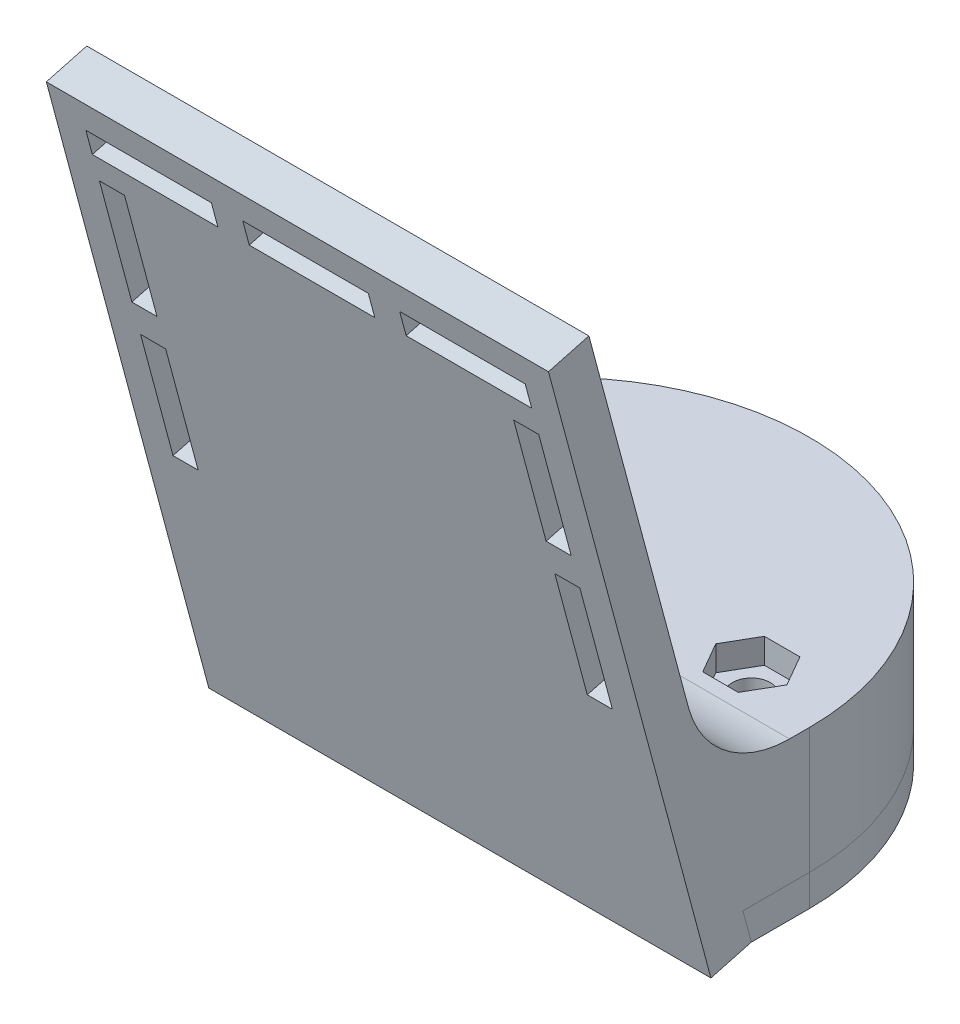
from build123d import *

# Parameters (mm, degrees)
SKETCH1_R           = 7.5
BOSS_EXTRUDE1_DEPTH = 2
SKETCH2_R           = 15.125
SKETCH2_R_2         = 2.25
BOSS_EXTRUDE2_DEPTH = 1.75
BOSS_EXTRUDE3_DEPTH = 15
CUT_EXTRUDE2_DEPTH  = 60
SKETCH8_W           = 60
SKETCH8_H           = 75
BOSS_EXTRUDE4_DEPTH = 5
SKETCH9_R           = 2.25
CUT_EXTRUDE4_DEPTH  = 20
SKETCH10_W          = 15
SKETCH10_H          = 3
SKETCH10_W_2        = 3
SKETCH10_H_2        = 15
CUT_EXTRUDE5_DEPTH  = 25
CUT_EXTRUDE6_DEPTH  = 3
FILLET1_R           = 12.5


with BuildPart() as part:
    # Sketch1 → Boss-Extrude1 (new body)
    with BuildSketch(Plane(origin=(0, 0, 0), x_dir=(1, 0, 0), z_dir=(0, 1, 0))):
        with BuildLine():
            Line((30, -6.04597789), (-30, -6.04597789))
            Line((-30, -6.04597789), (-30, 5.95402211))
            ThreePointArc((-30, 5.95402211), (0, 35.95402211), (30, 5.95402211))
            Line((30, 5.95402211), (30, -6.04597789))
        make_face()
        with Locations(Location((0, 18.45402211, 0), (0, 0, 270))):
            Circle(SKETCH1_R, mode=Mode.SUBTRACT)
    extrude(amount=BOSS_EXTRUDE1_DEPTH)

    # Sketch2 → Boss-Extrude2 (add)
    # profile 1 of 3: a face of its own
    with BuildSketch(Plane(origin=(0, 2, 0), x_dir=(1, 0, 0), z_dir=(0, 1, 0))):
        with BuildLine():
            Line((-30, -6.04597789), (30, -6.04597789))
            Line((30, -6.04597789), (30, 5.95402211))
            ThreePointArc((30, 5.95402211), (0, 35.95402211), (-30, 5.95402211))
            Line((-30, 5.95402211), (-30, -6.04597789))
        make_face()
        with Locations(Location((0, 18.45402211, 0), (0, 0, 270))):
            Circle(SKETCH2_R, mode=Mode.SUBTRACT)
    # profile 2 of 3: a face of its own
    with BuildSketch(Plane(origin=(0, 2, 0), x_dir=(1, 0, 0), z_dir=(0, 1, 0))):
        with Locations(Location((0, 28.95402211, 0), (0, 0, 270))):
            Circle(SKETCH2_R_2)
    # profile 3 of 3: a face of its own
    with BuildSketch(Plane(origin=(0, 2, 0), x_dir=(1, 0, 0), z_dir=(0, 1, 0))):
        with Locations(Location((2.387171141, 8.228983531, 0), (0, 0, 270))):
            Circle(SKETCH2_R_2)
    extrude(amount=BOSS_EXTRUDE2_DEPTH)


with BuildPart() as body_2:
    # Sketch5 → Boss-Extrude3 (new body)
    with BuildSketch(Plane(origin=(0, 3.75, 0), x_dir=(1, 0, 0), z_dir=(0, 1, 0))):
        with BuildLine():
            Line((-30, -6.04597789), (30, -6.04597789))
            Line((30, -6.04597789), (30, 5.95402211))
            ThreePointArc((30, 5.95402211), (0, 35.95402211), (-30, 5.95402211))
            Line((-30, 5.95402211), (-30, -6.04597789))
        make_face()
    extrude(amount=BOSS_EXTRUDE3_DEPTH)


with BuildPart() as cut_extrude2_tool:
    # Sketch6 → Cut-Extrude2 (new body)
    with BuildSketch(Plane.ZY.offset(30)):
        Polygon((6.04597789, 18.75), (6.04597789, 0), (1.021930531, 0), align=None)
    extrude(amount=-CUT_EXTRUDE2_DEPTH)


with BuildPart() as part_1:
    add(part.part)

    # Cut-Extrude2: cut by cut_extrude2_tool
    add(cut_extrude2_tool.part, mode=Mode.SUBTRACT)


with BuildPart() as body_2_1:
    add(body_2.part)

    # Cut-Extrude2: cut by cut_extrude2_tool
    add(cut_extrude2_tool.part, mode=Mode.SUBTRACT)

    # Sketch8 → Boss-Extrude4 (add)
    with BuildSketch(Plane(origin=(0, -0.255482633, 0.953474166), x_dir=(1, 0, 0), z_dir=(0, -0.25881904510252135, 0.9659258262890681))):
        with Locations((0, 37.764495084)):
            Rectangle(SKETCH8_W, SKETCH8_H)
    extrude(amount=BOSS_EXTRUDE4_DEPTH)


with BuildPart() as cut_extrude4_tool:
    # Sketch9 → Cut-Extrude4 (new body)
    with BuildSketch(Plane.XZ):
        with Locations(Location((-20, -8.978069469, 0), (0, 0, 90))):
            Circle(SKETCH9_R)
        with Locations(Location((20, -8.978069469, 0), (0, 0, 90))):
            Circle(SKETCH9_R)
    extrude(amount=-CUT_EXTRUDE4_DEPTH)


with BuildPart() as part_2:
    add(part_1.part)

    # Cut-Extrude4: cut by cut_extrude4_tool
    add(cut_extrude4_tool.part, mode=Mode.SUBTRACT)


with BuildPart() as body_2_2:
    add(body_2_1.part)

    # Cut-Extrude4: cut by cut_extrude4_tool
    add(cut_extrude4_tool.part, mode=Mode.SUBTRACT)

    # Sketch10 → Cut-Extrude5 (cut)
    with BuildSketch(Plane(origin=(0, -0.255482633, 0.953474166), x_dir=(-1, 0, 0), z_dir=(0, 0.25881904510252135, -0.9659258262890681))):
        with Locations((-18.75, 70.014495084)):
            Rectangle(SKETCH10_W, SKETCH10_H)
        with Locations((0, 70.014495084)):
            Rectangle(SKETCH10_W, SKETCH10_H)
        with Locations((18.75, 70.014495084)):
            Rectangle(SKETCH10_W, SKETCH10_H)
        with Locations((-24.75, 38.764495084)):
            Rectangle(SKETCH10_W_2, SKETCH10_H_2)
        with Locations((-24.75, 57.764495084)):
            Rectangle(SKETCH10_W_2, SKETCH10_H_2)
        with Locations((24.75, 38.764495084)):
            Rectangle(SKETCH10_W_2, SKETCH10_H_2)
        with Locations((24.75, 57.764495084)):
            Rectangle(SKETCH10_W_2, SKETCH10_H_2)
    extrude(amount=-CUT_EXTRUDE5_DEPTH, mode=Mode.SUBTRACT)

    # Sketch11 → Cut-Extrude6 (cut)
    with BuildSketch(Plane(origin=(0, 18.75, 0), x_dir=(1, 0, 0), z_dir=(0, 1, 0))):
        Polygon((-17.875, 12.658677435), (-22.125, 12.658677435), (-24.25, 8.978069469), (-22.125, 5.297461502), (-17.875, 5.297461502), (-15.75, 8.978069469), align=None)
        Polygon((22.125, 12.658677435), (17.875, 12.658677435), (15.75, 8.978069469), (17.875, 5.297461502), (22.125, 5.297461502), (24.25, 8.978069469), align=None)
    extrude(amount=-CUT_EXTRUDE6_DEPTH, mode=Mode.SUBTRACT)

    # Fillet1
    fillet1_edges = [body_2_2.edges().sort_by_distance(p)[0] for p in [
        (0, 18.75, 6.04597789),
    ]]
    fillet(fillet1_edges, radius=FILLET1_R)


solid = Compound([part_2.part, body_2_2.part])
